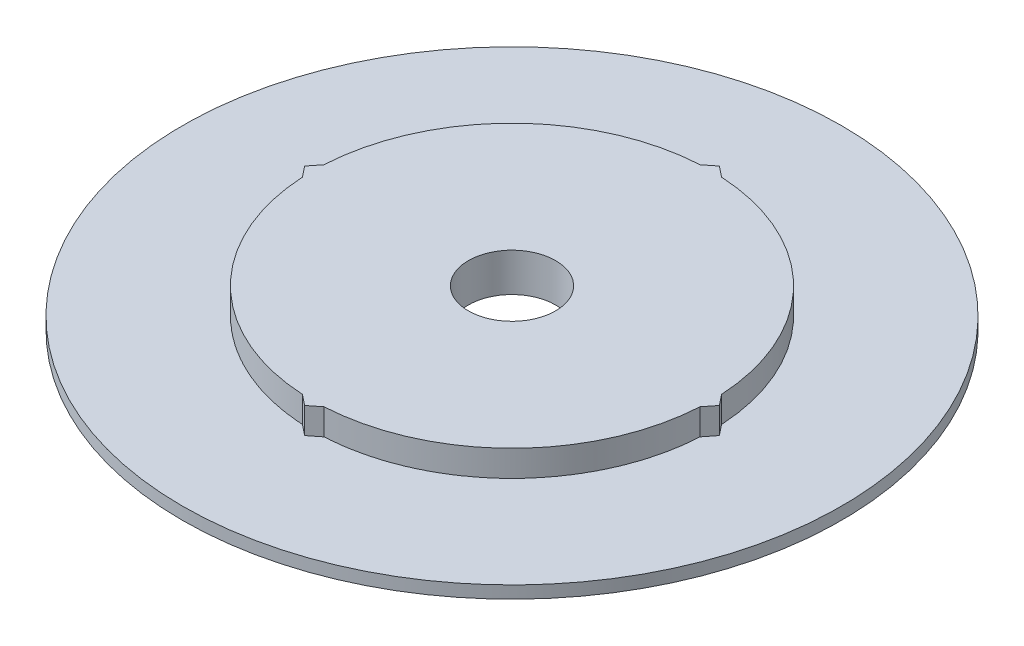
from build123d import *

# Parameters (mm, degrees)
SKETCH1_R           = 24
SKETCH1_R_2         = 14.5
BOSS_EXTRUDE1_DEPTH = 0.9
SKETCH2_R           = 14.5
SKETCH2_R_2         = 3.175
BOSS_EXTRUDE2_DEPTH = 2.8
BOSS_EXTRUDE3_START = -2.8
BOSS_EXTRUDE3_DEPTH = 2.8


with BuildPart() as part:
    # Sketch1 → Boss-Extrude1 (new body)
    with BuildSketch(Plane(origin=(0, 0, 0), x_dir=(1, 0, 0), z_dir=(0, 1, 0))):
        with Locations(Location((0, 0, 0), (0, 0, 270))):
            Circle(SKETCH1_R)
        with Locations(Location((0, 0, 0), (0, 0, 270))):
            Circle(SKETCH1_R_2, mode=Mode.SUBTRACT)
    extrude(amount=BOSS_EXTRUDE1_DEPTH)


with BuildPart() as body_2:
    # Sketch2 → Boss-Extrude2 (new body)
    with BuildSketch(Plane.XZ):
        with Locations(Location((0, 0, 0), (0, 0, 270))):
            Circle(SKETCH2_R)
        with Locations(Location((0, 0, 0), (0, 0, 270))):
            Circle(SKETCH2_R_2, mode=Mode.SUBTRACT)
    extrude(amount=-BOSS_EXTRUDE2_DEPTH)

    # Sketch3 → Boss-Extrude3 (add)
    with BuildSketch(Plane(origin=(0, 2.8, 0), x_dir=(1, 0, 0), z_dir=(0, 1, 0)).offset(BOSS_EXTRUDE3_START)):
        with BuildLine():
            Line((-15.1, 0), (-14.478807947, 0.783658365))
            ThreePointArc((-14.478807947, 0.783658365), (-14.5, 0), (-14.478807947, -0.783658365))
            Line((-14.478807947, -0.783658365), (-15.1, 0))
        make_face()
        with BuildLine():
            Line((0, 15.1), (0.783658365, 14.478807947))
            ThreePointArc((0.783658365, 14.478807947), (0, 14.5), (-0.783658365, 14.478807947))
            Line((-0.783658365, 14.478807947), (0, 15.1))
        make_face()
        with BuildLine():
            Line((15.1, 0), (14.478807947, -0.783658365))
            ThreePointArc((14.478807947, -0.783658365), (14.5, 0), (14.478807947, 0.783658365))
            Line((14.478807947, 0.783658365), (15.1, 0))
        make_face()
        with BuildLine():
            Line((0, -15.1), (-0.783658365, -14.478807947))
            ThreePointArc((-0.783658365, -14.478807947), (0, -14.5), (0.783658365, -14.478807947))
            Line((0.783658365, -14.478807947), (0, -15.1))
        make_face()
    extrude(amount=BOSS_EXTRUDE3_DEPTH)


solid = Compound([part.part, body_2.part])
